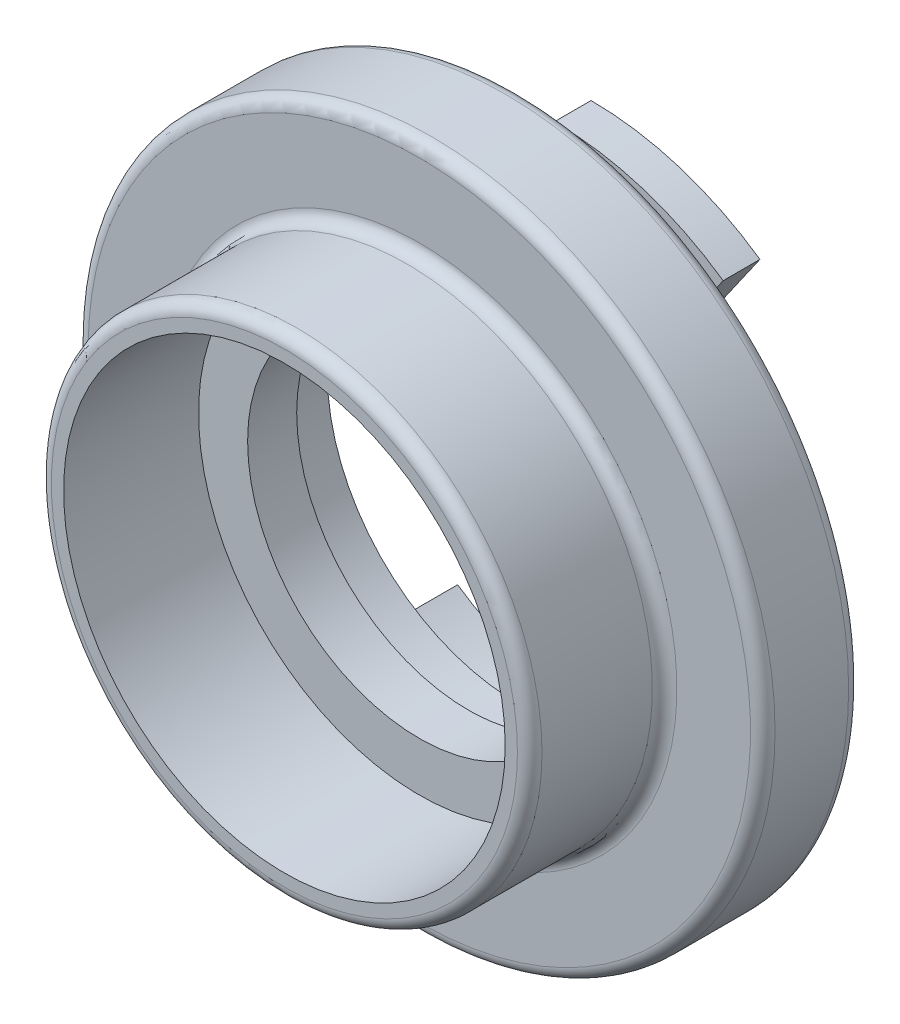
from build123d import *

# Parameters (mm, degrees)
SKETCH1_R           = 25.4
BOSS_EXTRUDE1_DEPTH = 13.97
SKETCH2_R           = 22.86
CUT_EXTRUDE1_DEPTH  = 25.4
SKETCH3_R           = 35.56
BOSS_EXTRUDE2_DEPTH = 10.16
SKETCH4_R           = 17.78
CUT_EXTRUDE2_DEPTH  = 10.16
CUT_EXTRUDE3_DEPTH  = 7.62
CUT_EXTRUDE4_DEPTH  = 5.08
BOSS_EXTRUDE3_START = 3.81
BOSS_EXTRUDE3_DEPTH = 3.81
BOSS_EXTRUDE4_START = 3.81
BOSS_EXTRUDE4_DEPTH = 3.81
FILLET1_R           = 1.27
FILLET2_R           = 1.27
BOSS_EXTRUDE5_START = 3.81
BOSS_EXTRUDE5_DEPTH = 3.81
BOSS_EXTRUDE6_START = 3.81
BOSS_EXTRUDE6_DEPTH = 3.81
SKETCH12_R          = 19.685
SKETCH12_R_2        = 15.494
CUT_EXTRUDE5_DEPTH  = 5.08
CUT_EXTRUDE6_DEPTH  = 7.62
CUT_EXTRUDE7_DEPTH  = 5.08


with BuildPart() as part:
    # Sketch1 → Boss-Extrude1 (new body)
    with BuildSketch(Plane.XY):
        Circle(SKETCH1_R)
    extrude(amount=BOSS_EXTRUDE1_DEPTH)

    # Sketch2 → Cut-Extrude1 (cut)
    with BuildSketch(Plane.XY.offset(13.97)):
        Circle(SKETCH2_R)
    extrude(amount=-CUT_EXTRUDE1_DEPTH, mode=Mode.SUBTRACT)

    # Sketch3 → Boss-Extrude2 (add)
    with BuildSketch(Plane(origin=(0, 0, 0), x_dir=(-1, 0, 0), z_dir=(0, 0, -1))):
        Circle(SKETCH3_R)
    extrude(amount=BOSS_EXTRUDE2_DEPTH)

    # Sketch4 → Cut-Extrude2 (cut)
    with BuildSketch(Plane(origin=(0, 0, -10.16), x_dir=(-1, 0, 0), z_dir=(0, 0, -1))):
        Circle(SKETCH4_R)
    extrude(amount=-CUT_EXTRUDE2_DEPTH, mode=Mode.SUBTRACT)

    # Sketch5 → Cut-Extrude3 (cut)
    with BuildSketch(Plane(origin=(0, 0, -10.16), x_dir=(-1, 0, 0), z_dir=(0, 0, -1))):
        with BuildLine():
            Line((0, 24.13), (0, 30.48))
            ThreePointArc((0, 30.48), (10.414, 28.645750191), (19.574595964, 23.363766667))
            ThreePointArc((19.574595964, 23.363766667), (20.902767484, 21.720232391), (21.5114344, 19.696678812))
            ThreePointArc((21.5114344, 19.696678812), (21.950994255, 17.793379172), (22.86, 16.064370514))
            ThreePointArc((22.86, 16.064370514), (27.516036857, -4.848846843), (15.991836773, -22.9108))
            Line((15.991836773, -22.9108), (13.811131758, -19.7866))
            ThreePointArc((13.811131758, -19.7866), (23.01855293, 7.239), (0, 24.13))
        make_face()
    extrude(amount=-CUT_EXTRUDE3_DEPTH, mode=Mode.SUBTRACT)

    # Sketch7 → Cut-Extrude4 (cut)
    with BuildSketch(Plane(origin=(0, 0, -7.62), x_dir=(-1, 0, 0), z_dir=(0, 0, -1))):
        with BuildLine():
            Line((17.445640116, -24.9936), (15.991836773, -22.9108))
            ThreePointArc((15.991836773, -22.9108), (27.516036857, -4.848846843), (22.86, 16.064370514))
            ThreePointArc((22.86, 16.064370514), (21.950994255, 17.793379172), (21.5114344, 19.696678812))
            ThreePointArc((21.5114344, 19.696678812), (20.902767484, 21.720232391), (19.574595964, 23.363766667))
            ThreePointArc((19.574595964, 23.363766667), (30.450504061, -1.340597786), (17.445640116, -24.9936))
        make_face()
    extrude(amount=-CUT_EXTRUDE4_DEPTH, mode=Mode.SUBTRACT)

    # Sketch8 → Boss-Extrude3 (add)
    with BuildSketch(Plane(origin=(0, 0, -10.16), x_dir=(-1, 0, 0), z_dir=(0, 0, -1)).offset(BOSS_EXTRUDE3_START)):
        with BuildLine():
            Line((0, -27.94), (0, -24.13))
            ThreePointArc((0, -24.13), (7.239, -23.01855293), (13.811131758, -19.7866))
            Line((13.811131758, -19.7866), (15.991836773, -22.9108))
            ThreePointArc((15.991836773, -22.9108), (8.382, -26.653061288), (0, -27.94))
        make_face()
    extrude(amount=-BOSS_EXTRUDE3_DEPTH)

    # Sketch9 → Boss-Extrude4 (add)
    with BuildSketch(Plane(origin=(0, 0, -13.97), x_dir=(-1, 0, 0), z_dir=(0, 0, -1)).offset(BOSS_EXTRUDE4_START)):
        with BuildLine():
            Line((0, -24.13), (0, -30.48))
            ThreePointArc((0, -30.48), (9.144, -29.076066859), (17.445640116, -24.9936))
            Line((17.445640116, -24.9936), (13.811131758, -19.7866))
            ThreePointArc((13.811131758, -19.7866), (7.239, -23.01855293), (0, -24.13))
        make_face()
    extrude(amount=-BOSS_EXTRUDE4_DEPTH)

    # Fillet1
    fillet1_edges = [part.edges().sort_by_distance(p)[0] for p in [
        (35.56, 0, -10.16),
    ]]
    fillet(fillet1_edges, radius=FILLET1_R)

    # Fillet2
    fillet2_edges = [part.edges().sort_by_distance(p)[0] for p in [
        (-25.4, 0, 0),
        (35.56, 0, 0),
        (-25.4, 0, 13.97),
    ]]
    fillet(fillet2_edges, radius=FILLET2_R)

    # Sketch10 → Boss-Extrude5 (add)
    with BuildSketch(Plane(origin=(0, 0, -10.16), x_dir=(-1, 0, 0), z_dir=(0, 0, -1)).offset(BOSS_EXTRUDE5_START)):
        with BuildLine():
            Line((-13.819909091, 19.780470488), (-16.002, 22.90370267))
            ThreePointArc((-16.002, 22.90370267), (-8.387912356, 26.651201217), (0, 27.94))
            Line((0, 27.94), (0, 24.13))
            ThreePointArc((0, 24.13), (-7.244106126, 23.016946505), (-13.819909091, 19.780470488))
        make_face()
    extrude(amount=-BOSS_EXTRUDE5_DEPTH)

    # Sketch11 → Boss-Extrude6 (add)
    with BuildSketch(Plane(origin=(0, 0, -13.97), x_dir=(-1, 0, 0), z_dir=(0, 0, -1)).offset(BOSS_EXTRUDE6_START)):
        with BuildLine():
            Line((-13.819909091, 19.780470488), (-17.486542269, 25.028531737))
            ThreePointArc((-17.486542269, 25.028531737), (-9.166078238, 29.123694325), (0, 30.53205793))
            Line((0, 30.53205793), (0, 24.13))
            ThreePointArc((0, 24.13), (-7.244106126, 23.016946505), (-13.819909091, 19.780470488))
        make_face()
    extrude(amount=-BOSS_EXTRUDE6_DEPTH)

    # Sketch12 → Cut-Extrude5 (cut)
    with BuildSketch(Plane(origin=(0, 0, -10.16), x_dir=(-1, 0, 0), z_dir=(0, 0, -1))):
        Circle(SKETCH12_R)
        Circle(SKETCH12_R_2, mode=Mode.SUBTRACT)
    extrude(amount=-CUT_EXTRUDE5_DEPTH, mode=Mode.SUBTRACT)

    # Sketch13 → Cut-Extrude6 (cut)
    with BuildSketch(Plane(origin=(0, 0, -10.16), x_dir=(-1, 0, 0), z_dir=(0, 0, -1))):
        with BuildLine():
            Line((-16.002, 22.90370267), (-13.819909091, 19.780470488))
            ThreePointArc((-13.819909091, 19.780470488), (-23.016946505, -7.244106126), (0, -24.13))
            Line((0, -24.13), (0, -30.48))
            ThreePointArc((0, -30.48), (-10.414, -28.645750191), (-19.574595964, -23.363766667))
            ThreePointArc((-19.574595964, -23.363766667), (-20.902767484, -21.720232391), (-21.5114344, -19.696678812))
            ThreePointArc((-21.5114344, -19.696678812), (-21.950994255, -17.793379172), (-22.86, -16.064370514))
            ThreePointArc((-22.86, -16.064370514), (-27.51711182, 4.842742724), (-16.002, 22.90370267))
        make_face()
    extrude(amount=-CUT_EXTRUDE6_DEPTH, mode=Mode.SUBTRACT)

    # Sketch15 → Cut-Extrude7 (cut)
    with BuildSketch(Plane(origin=(0, 0, -7.62), x_dir=(-1, 0, 0), z_dir=(0, 0, -1))):
        with BuildLine():
            Line((-17.456727273, 24.985857458), (-16.002, 22.90370267))
            ThreePointArc((-16.002, 22.90370267), (-27.51711182, 4.842742724), (-22.86, -16.064370514))
            ThreePointArc((-22.86, -16.064370514), (-21.950994255, -17.793379172), (-21.5114344, -19.696678812))
            ThreePointArc((-21.5114344, -19.696678812), (-20.902767484, -21.720232391), (-19.574595964, -23.363766667))
            ThreePointArc((-19.574595964, -23.363766667), (-30.450800702, 1.333842788), (-17.456727273, 24.985857458))
        make_face()
    extrude(amount=-CUT_EXTRUDE7_DEPTH, mode=Mode.SUBTRACT)


solid = part.part
